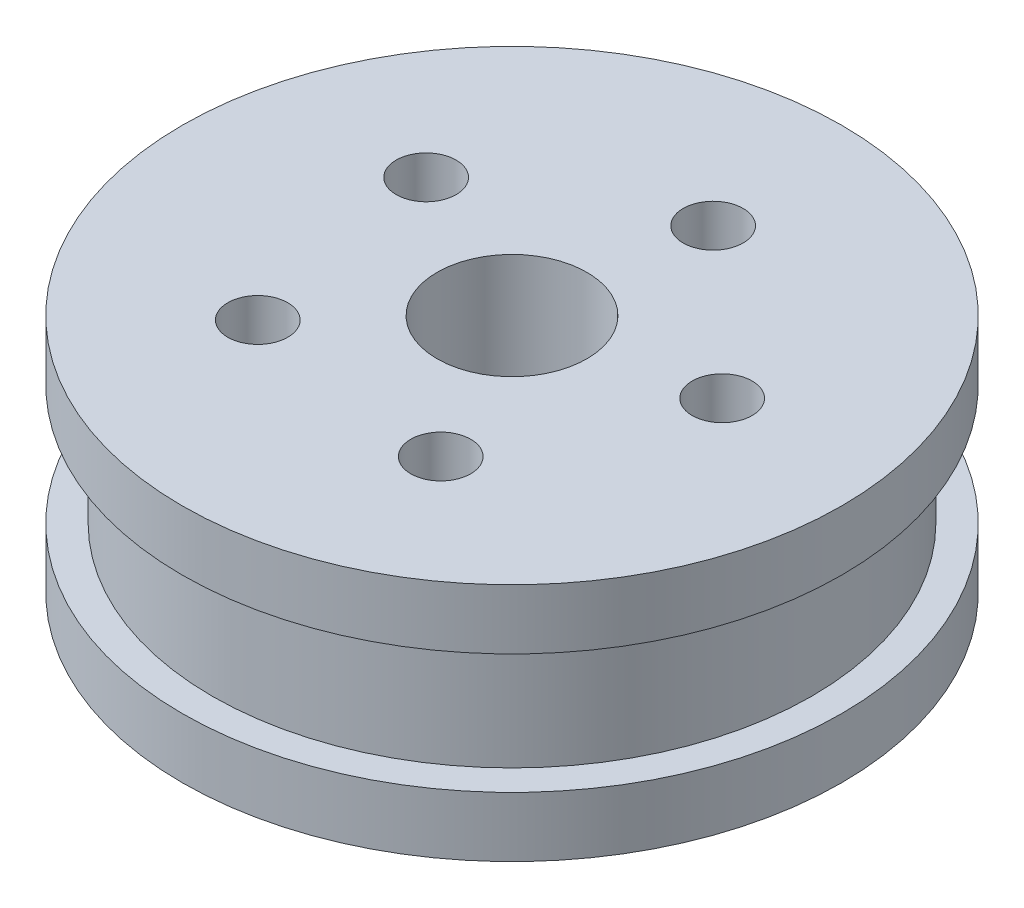
from build123d import *

# Parameters (mm, degrees)
SKETCH4_R          = 3.175
CUT_EXTRUDE3_DEPTH = 33.848593577
SKETCH6_R          = 1.27
CUT_EXTRUDE5_DEPTH = 33.848593577


with BuildPart() as part:
    # Sketch1 → Revolve1 (revolve)
    with BuildSketch(Plane.XY, mode=Mode.PRIVATE) as revolve1_sk:
        Polygon((0, 0), (0, 2.54), (13.97, 2.54), (13.97, -7.62), (0, -7.62), (0, -5.08), (1.27, -5.08), (1.27, 0), align=None)
    revolve(revolve1_sk.sketch.rotate(Axis((13.97, -7.62, 0), (0, 1, 0)), 270), axis=Axis((13.97, -7.62, 0), (0, 1, 0)))

    # Sketch4 → Cut-Extrude3 (cut, through all)
    with BuildSketch(Plane(origin=(0, 2.54, 0), x_dir=(1, 0, 0), z_dir=(0, 1, 0))):
        with Locations(Location((13.97, 0, 0), (0, 0, 270))):
            Circle(SKETCH4_R)
    extrude(amount=-CUT_EXTRUDE3_DEPTH, mode=Mode.SUBTRACT)

    # Sketch6 → Cut-Extrude5 (cut, through all)
    with BuildSketch(Plane(origin=(0, 2.54, 0), x_dir=(1, 0, 0), z_dir=(0, 1, 0))):
        with Locations(Location((7.079305779, 3.253111304, 0), (0, 0, 270))):
            Circle(SKETCH6_R)
        with Locations(Location((14.934551087, 7.558706318, 0), (0, 0, 270))):
            Circle(SKETCH6_R)
        with Locations(Location((21.456819576, 1.418426111, 0), (0, 0, 270))):
            Circle(SKETCH6_R)
        with Locations(Location((17.632557879, -6.682070771, 0), (0, 0, 270))):
            Circle(SKETCH6_R)
        with Locations(Location((8.746765678, -5.548172963, 0), (0, 0, 270))):
            Circle(SKETCH6_R)
    extrude(amount=-CUT_EXTRUDE5_DEPTH, mode=Mode.SUBTRACT)


solid = part.part
